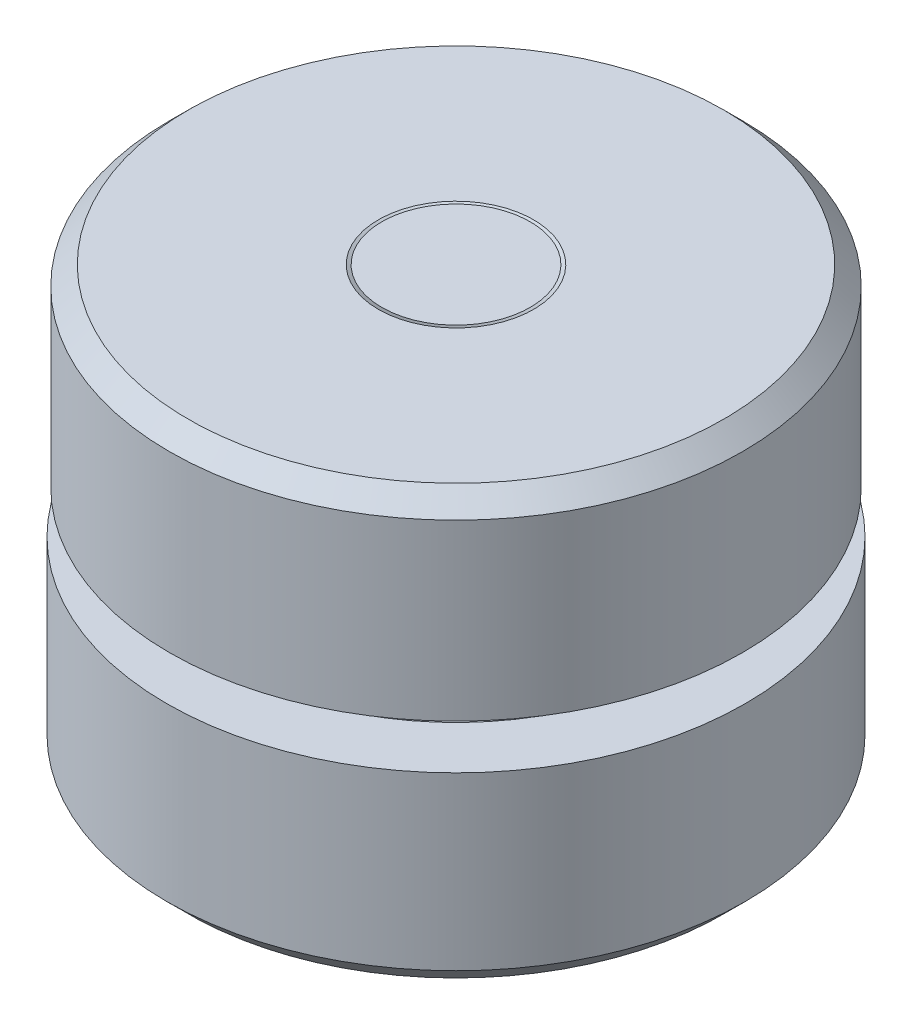
from build123d import *

# Parameters (mm, degrees)
CIRPATTERN1_COUNT = 4
CIRPATTERN1_ANGLE = 270
SKETCH5_W         = 0.1984375
SKETCH5_H         = 14.2875


with BuildPart() as part:
    # Sketch1 → Revolve1 (revolve)
    with BuildSketch(Plane(origin=(0, 0, 0), x_dir=(0, 0, -1), z_dir=(1, 0, 0))):
        with BuildLine():
            Line((-19.84375, 15.875), (0, 15.875))
            Line((0, 15.875), (0, 1.5875))
            Line((0, 1.5875), (-4.567263938, 1.5875))
            ThreePointArc((-4.567263938, 1.5875), (-10.715625, 6.35), (-16.863986062, 1.5875))
            Line((-16.863986062, 1.5875), (-21.43125, 1.5875))
            Line((-21.43125, 1.5875), (-21.43125, 14.2875))
            Line((-21.43125, 14.2875), (-19.84375, 15.875))
        make_face()
        with BuildLine():
            Line((0, -15.875), (0, -1.5875))
            Line((0, -1.5875), (-4.567263938, -1.5875))
            ThreePointArc((-4.567263938, -1.5875), (-10.715625, -6.35), (-16.863986062, -1.5875))
            Line((-16.863986062, -1.5875), (-21.43125, -1.5875))
            Line((-21.43125, -1.5875), (-21.43125, -14.2875))
            Line((-21.43125, -14.2875), (-19.84375, -15.875))
            Line((-19.84375, -15.875), (0, -15.875))
        make_face()
    revolve(axis=Axis((0, -15.875, 0), (0, 1, 0)))

    # Sketch4 → Cut-Revolve1 (revolve, cut)
    with BuildSketch(Plane(origin=(0, 0, 0), x_dir=(0, 0, -1), z_dir=(1, 0, 0))):
        Polygon((-5.753261314, 15.875), (-3.003630657, 14.2875), (-3.003630657, -14.2875), (-5.753261314, -15.875), (-5.499261314, -15.875), (-2.876630657, -14.360823484), (-2.876630657, 14.360823484), (-5.499261314, 15.875), align=None)
    revolve(axis=Axis((0, 15.875, 0), (0, -1, 0)), mode=Mode.SUBTRACT)

    # Sketch5 → Cut-Revolve2 (revolve, cut)
    with BuildSketch(Plane(origin=(0, 0, 0), x_dir=(0, 0, -1), z_dir=(1, 0, 0))):
        with Locations((-21.33203125, 8.73125)):
            Rectangle(SKETCH5_W, SKETCH5_H)
    revolve(axis=Axis((0, -15.875, 0), (0, 1, 0)), mode=Mode.SUBTRACT)


with BuildPart() as body_2:
    # Sketch3 → Revolve2 (revolve)
    with BuildSketch(Plane(origin=(0, 0, 0), x_dir=(0, 0, -1), z_dir=(1, 0, 0))):
        with BuildLine():
            Line((-10.715625, 6.35), (-10.715625, -6.35))
            ThreePointArc((-10.715625, -6.35), (-17.065625, 0), (-10.715625, 6.35))
        make_face()
    revolve(axis=Axis((0, 6.35, 10.715625), (0, -1, 0)))


with BuildPart() as cirpattern1_1:
    # CirPattern1: pattern copy
    add(body_2.part.rotate(Axis((0, 15.875, 0), (0, -1, 0)), 1 * CIRPATTERN1_ANGLE / (CIRPATTERN1_COUNT - 1)))


with BuildPart() as cirpattern1_2:
    # CirPattern1: pattern copy
    add(body_2.part.rotate(Axis((0, 15.875, 0), (0, -1, 0)), 2 * CIRPATTERN1_ANGLE / (CIRPATTERN1_COUNT - 1)))


with BuildPart() as cirpattern1_3:
    # CirPattern1: pattern copy
    add(body_2.part.rotate(Axis((0, 15.875, 0), (0, -1, 0)), 3 * CIRPATTERN1_ANGLE / (CIRPATTERN1_COUNT - 1)))


solid = Compound([part.part, body_2.part, cirpattern1_1.part, cirpattern1_2.part, cirpattern1_3.part])
